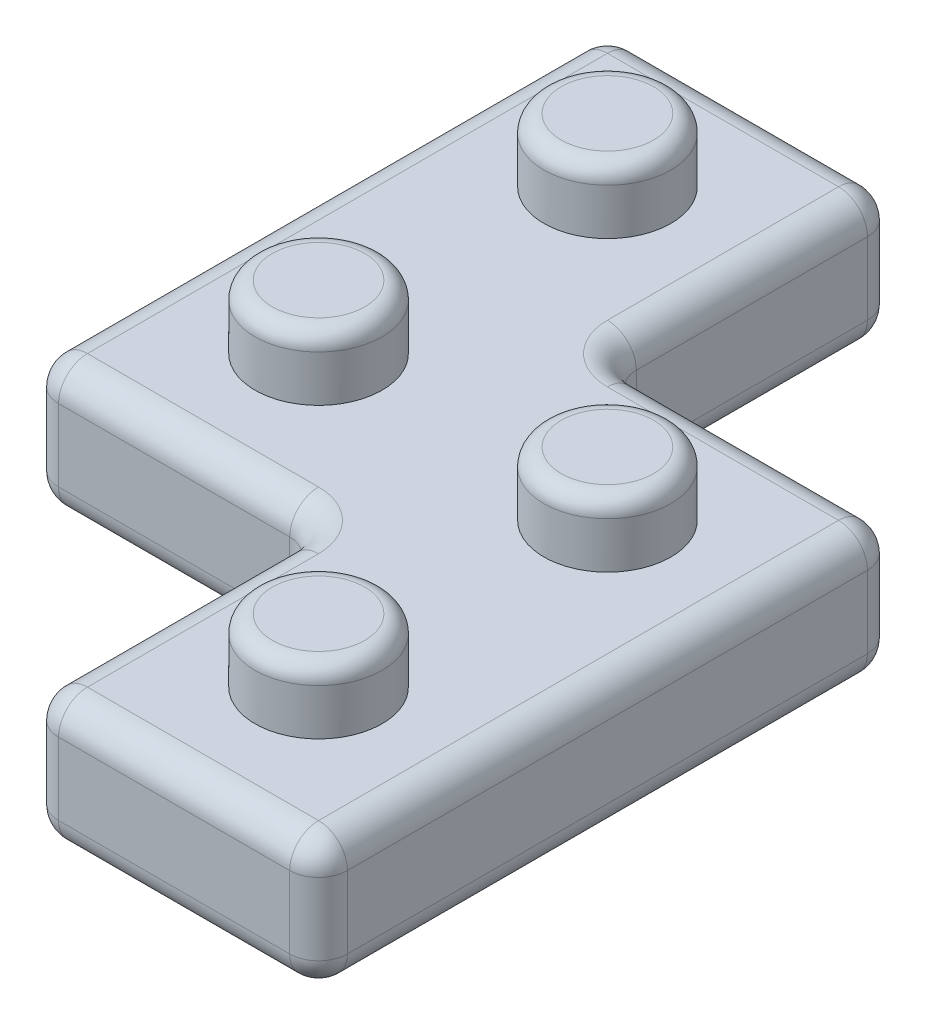
from build123d import *

# Parameters (mm, degrees)
BOSS_EXTRUDE1_DEPTH = 5.715
SKETCH2_R           = 2.794
BOSS_EXTRUDE2_DEPTH = 2.794
FILLET4_R           = 1.27
FILLET5_R           = 1.27
FILLET7_R           = 0.762


with BuildPart() as part:
    # Sketch1 → Boss-Extrude1 (new body)
    with BuildSketch(Plane(origin=(0, 0, 0), x_dir=(1, 0, 0), z_dir=(0, 1, 0))):
        with BuildLine():
            Line((-11.43, 12.7), (-1.27, 12.7))
            ThreePointArc((-1.27, 12.7), (-0.371974388, 12.328025612), (0, 11.43))
            Line((0, 11.43), (0, 1.27))
            ThreePointArc((0, 1.27), (0.371974388, 0.371974388), (1.27, 0))
            Line((1.27, 0), (11.43, 0))
            ThreePointArc((11.43, 0), (12.328025612, -0.371974388), (12.7, -1.27))
            Line((12.7, -1.27), (12.7, -24.13))
            ThreePointArc((12.7, -24.13), (12.328025612, -25.028025612), (11.43, -25.4))
            Line((11.43, -25.4), (1.27, -25.4))
            ThreePointArc((1.27, -25.4), (0.371974388, -25.028025612), (0, -24.13))
            Line((0, -24.13), (0, -13.97))
            ThreePointArc((0, -13.97), (-0.371974388, -13.071974388), (-1.27, -12.7))
            Line((-1.27, -12.7), (-11.43, -12.7))
            ThreePointArc((-11.43, -12.7), (-12.328025612, -12.328025612), (-12.7, -11.43))
            Line((-12.7, -11.43), (-12.7, 11.43))
            ThreePointArc((-12.7, 11.43), (-12.328025612, 12.328025612), (-11.43, 12.7))
        make_face()
    extrude(amount=-BOSS_EXTRUDE1_DEPTH)

    # Sketch2 → Boss-Extrude2 (add)
    with BuildSketch(Plane(origin=(0, 0, 0), x_dir=(1, 0, 0), z_dir=(0, 1, 0))):
        with Locations(Location((-6.35, 6.35, 0), (0, 0, 90))):
            Circle(SKETCH2_R)
        with Locations(Location((-6.35, -6.35, 0), (0, 0, 90))):
            Circle(SKETCH2_R)
        with Locations(Location((6.35, -6.35, 0), (0, 0, 90))):
            Circle(SKETCH2_R)
        with Locations(Location((6.35, -19.05, 0), (0, 0, 90))):
            Circle(SKETCH2_R)
    extrude(amount=BOSS_EXTRUDE2_DEPTH)

    # Fillet4
    fillet4_edges = [part.edges().sort_by_distance(p)[0] for p in [
        (-6.35, 0, 12.7),
        (-0.371974388, 0, 13.071974388),
        (0, 0, 19.05),
        (0.371974388, 0, 25.028025612),
        (6.35, 0, 25.4),
        (12.328025612, 0, 25.028025612),
        (12.7, 0, 12.7),
        (12.328025612, 0, 0.371974388),
        (6.35, 0, 0),
        (0.371974388, 0, -0.371974388),
        (0, 0, -6.35),
        (-0.371974388, 0, -12.328025612),
        (-6.35, 0, -12.7),
        (-12.328025612, 0, -12.328025612),
        (-12.7, 0, 0),
        (-12.328025612, 0, 12.328025612),
    ]]
    fillet(fillet4_edges, radius=FILLET4_R)

    # Fillet5
    fillet5_edges = [part.edges().sort_by_distance(p)[0] for p in [
        (-12.328025612, -5.715, -12.328025612),
        (-6.35, -5.715, -12.7),
        (-0.371974388, -5.715, -12.328025612),
        (0, -5.715, -6.35),
        (0.371974388, -5.715, -0.371974388),
        (6.35, -5.715, 0),
        (12.328025612, -5.715, 0.371974388),
        (12.7, -5.715, 12.7),
        (12.328025612, -5.715, 25.028025612),
        (6.35, -5.715, 25.4),
        (-12.328025612, -5.715, 12.328025612),
        (0.371974388, -5.715, 25.028025612),
        (0, -5.715, 19.05),
        (-0.371974388, -5.715, 13.071974388),
        (-6.35, -5.715, 12.7),
        (-12.7, -5.715, 0),
    ]]
    fillet(fillet5_edges, radius=FILLET5_R)

    # Fillet7
    fillet7_edges = [part.edges().sort_by_distance(p)[0] for p in [
        (-6.35, 2.794, -3.556),
        (-6.35, 2.794, 9.144),
        (6.35, 2.794, 9.144),
        (6.35, 2.794, 21.844),
    ]]
    fillet(fillet7_edges, radius=FILLET7_R)


solid = part.part
